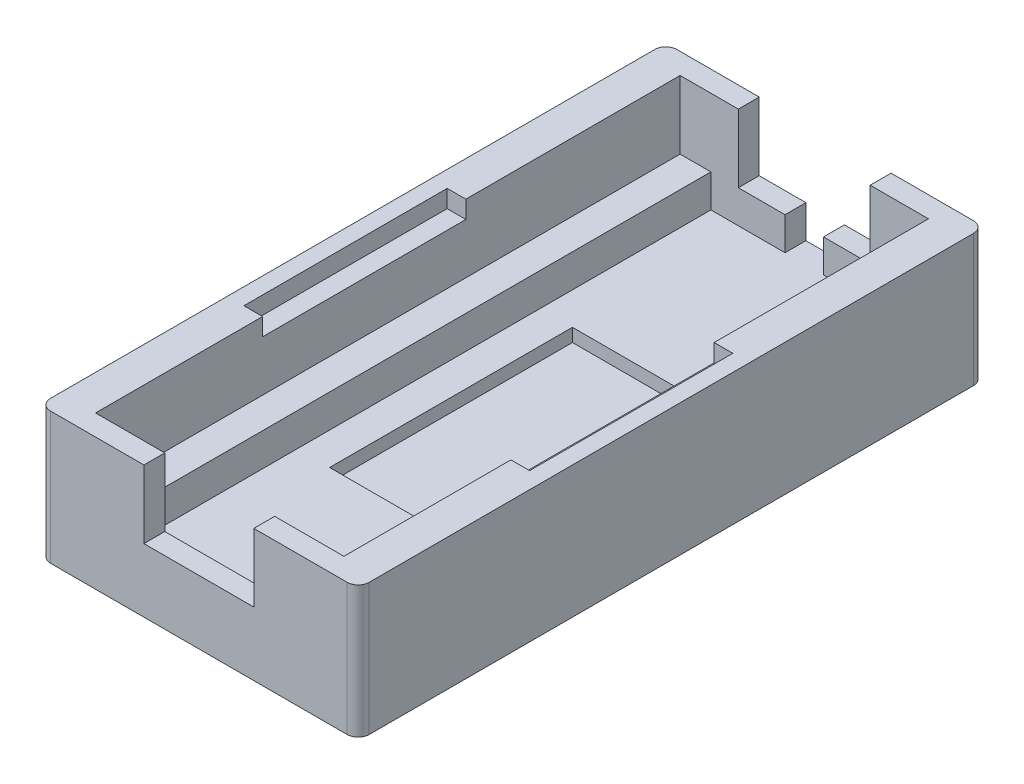
from build123d import *

# Parameters (mm, degrees)
SKETCH2_W           = 29
SKETCH2_H           = 57
BOSS_EXTRUDE1_DEPTH = 12
SKETCH3_W           = 22.6
SKETCH3_H           = 53.2
CUT_EXTRUDE1_DEPTH  = 6.2
SKETCH4_W           = 17
SKETCH4_H           = 53.2
CUT_EXTRUDE2_DEPTH  = 3
SKETCH5_W           = 11.1
SKETCH5_H           = 22.1
CUT_EXTRUDE3_DEPTH  = 1.2
SKETCH6_W           = 26
SKETCH6_H           = 18.5
CUT_EXTRUDE4_DEPTH  = 1.6
SKETCH7_W           = 12
SKETCH7_H           = 1.9
SKETCH7_W_2         = 10
CUT_EXTRUDE5_DEPTH  = 6.2
FILLET1_R           = 1
SKETCH8_W           = 3.5
SKETCH8_H           = 3
CUT_EXTRUDE6_DEPTH  = 10


with BuildPart() as part:
    # Sketch2 → Boss-Extrude1 (new body)
    with BuildSketch(Plane(origin=(0, 0, 0), x_dir=(1, 0, 0), z_dir=(0, 1, 0))):
        Rectangle(SKETCH2_W, SKETCH2_H)
    extrude(amount=BOSS_EXTRUDE1_DEPTH)

    # Sketch3 → Cut-Extrude1 (cut)
    with BuildSketch(Plane(origin=(0, 12, 0), x_dir=(1, 0, 0), z_dir=(0, 1, 0))):
        Rectangle(SKETCH3_W, SKETCH3_H)
    extrude(amount=-CUT_EXTRUDE1_DEPTH, mode=Mode.SUBTRACT)

    # Sketch4 → Cut-Extrude2 (cut)
    with BuildSketch(Plane(origin=(0, 5.8, 0), x_dir=(1, 0, 0), z_dir=(0, 1, 0))):
        Rectangle(SKETCH4_W, SKETCH4_H)
    extrude(amount=-CUT_EXTRUDE2_DEPTH, mode=Mode.SUBTRACT)

    # Sketch5 → Cut-Extrude3 (cut)
    with BuildSketch(Plane(origin=(0, 2.8, 0), x_dir=(1, 0, 0), z_dir=(0, 1, 0))):
        Rectangle(SKETCH5_W, SKETCH5_H)
    extrude(amount=-CUT_EXTRUDE3_DEPTH, mode=Mode.SUBTRACT)

    # Sketch6 → Cut-Extrude4 (cut)
    with BuildSketch(Plane(origin=(0, 12, 0), x_dir=(1, 0, 0), z_dir=(0, 1, 0))):
        with Locations((0, -2.15)):
            Rectangle(SKETCH6_W, SKETCH6_H)
    extrude(amount=-CUT_EXTRUDE4_DEPTH, mode=Mode.SUBTRACT)

    # Sketch7 → Cut-Extrude5 (cut)
    with BuildSketch(Plane(origin=(0, 12, 0), x_dir=(1, 0, 0), z_dir=(0, 1, 0))):
        with Locations((0, 27.55)):
            Rectangle(SKETCH7_W, SKETCH7_H)
        with Locations((0, -27.55)):
            Rectangle(SKETCH7_W_2, SKETCH7_H)
    extrude(amount=-CUT_EXTRUDE5_DEPTH, mode=Mode.SUBTRACT)

    # Fillet1
    fillet1_edges = [part.edges().sort_by_distance(p)[0] for p in [
        (14.5, 6, 28.5),
        (-14.5, 6, 28.5),
        (-14.5, 6, -28.5),
        (14.5, 6, -28.5),
    ]]
    fillet(fillet1_edges, radius=FILLET1_R)

    # Sketch8 → Cut-Extrude6 (cut)
    with BuildSketch(Plane(origin=(0, 0, -28.5), x_dir=(-1, 0, 0), z_dir=(0, 0, -1))):
        with Locations((0, 4.3)):
            Rectangle(SKETCH8_W, SKETCH8_H)
    extrude(amount=-CUT_EXTRUDE6_DEPTH, mode=Mode.SUBTRACT)


solid = part.part
